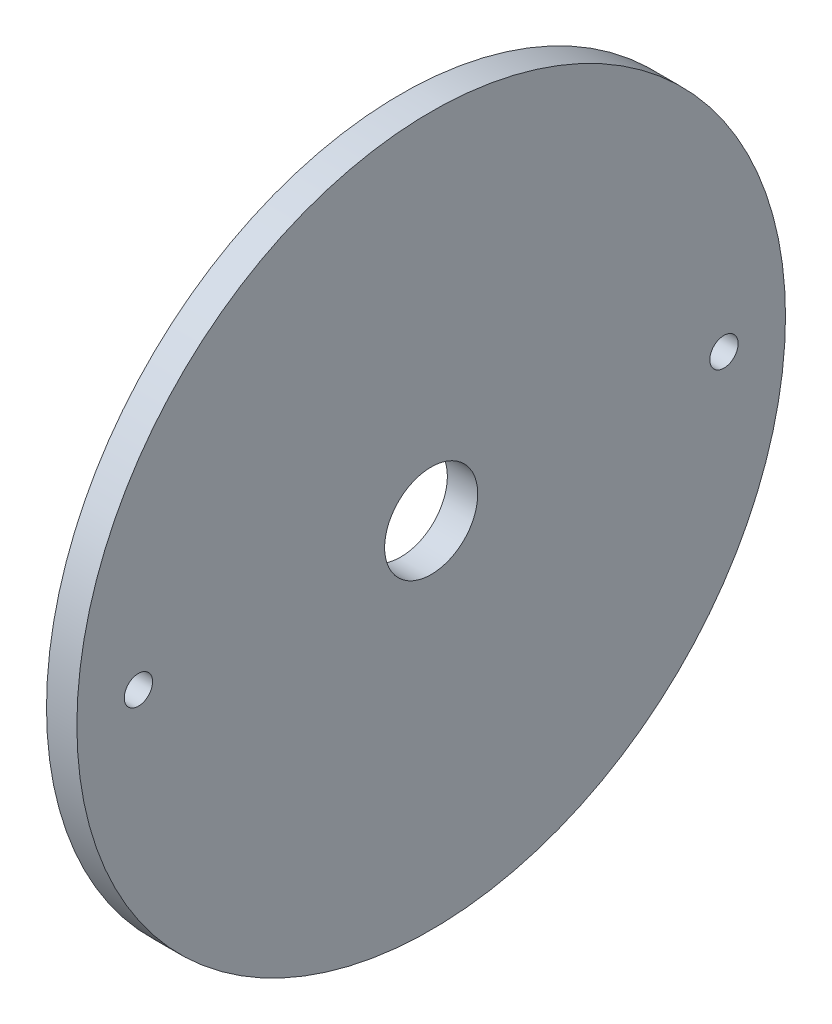
from build123d import *

# Parameters (mm, degrees)
SKETCH1_R           = 17.5
SKETCH1_R_2         = 2.3
SKETCH1_R_3         = 0.7
BOSS_EXTRUDE1_DEPTH = 1.5


with BuildPart() as part:
    # Sketch1 → Boss-Extrude1 (new body)
    with BuildSketch(Plane(origin=(0, 0, 0), x_dir=(0, 0, -1), z_dir=(1, 0, 0))):
        Circle(SKETCH1_R)
        Circle(SKETCH1_R_2, mode=Mode.SUBTRACT)
        with Locations((14.46, 0)):
            Circle(SKETCH1_R_3, mode=Mode.SUBTRACT)
        with Locations((-14.46, 0)):
            Circle(SKETCH1_R_3, mode=Mode.SUBTRACT)
    extrude(amount=BOSS_EXTRUDE1_DEPTH)


solid = part.part
